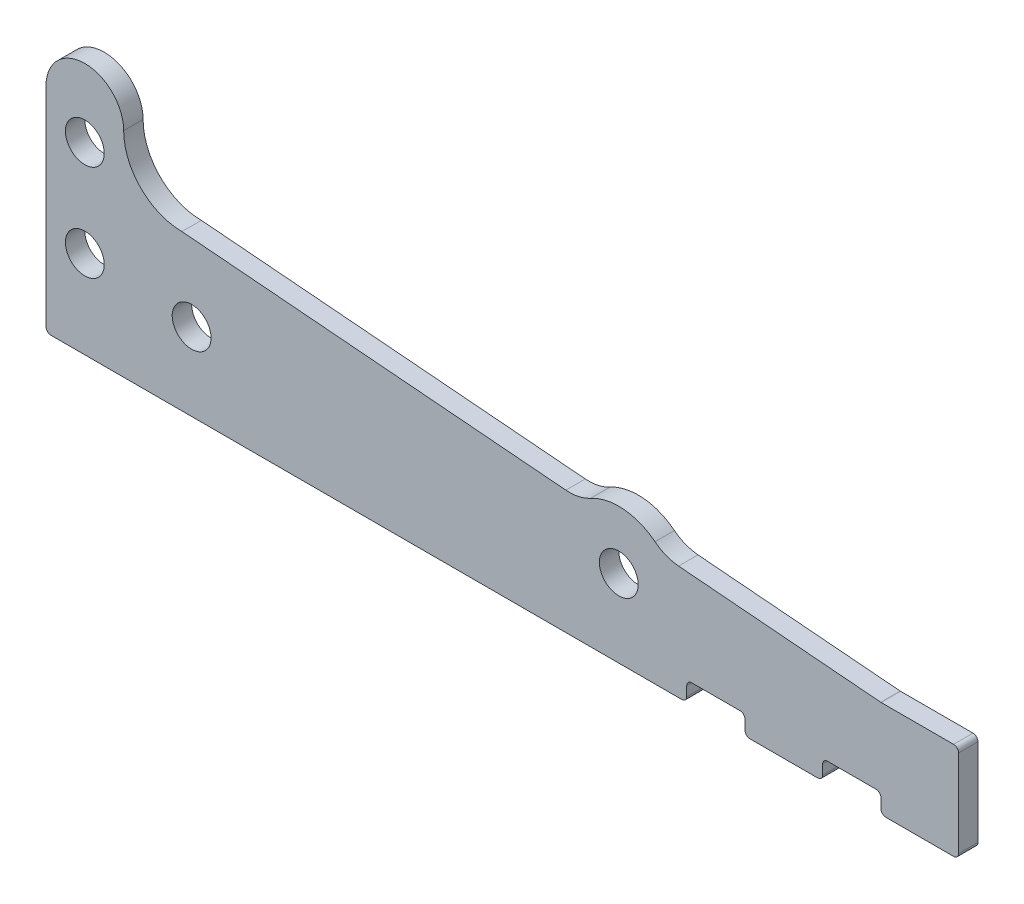
from build123d import *

# Parameters (mm, degrees)
SKETCH1_R           = 1.5875
BOSS_EXTRUDE1_DEPTH = 1.5875
FILLET1_R           = 0.4064
FILLET2_R           = 3.571875


with BuildPart() as part:
    # Sketch1 → Boss-Extrude1 (new body)
    with BuildSketch(Plane.XY):
        with BuildLine():
            Line((0, -1.5875), (52.3875, -1.5875))
            Line((52.3875, -1.5875), (52.3875, 0))
            Line((52.3875, 0), (57.15, 0))
            Line((57.15, 0), (57.15, -1.5875))
            Line((57.15, -1.5875), (63.5, -1.5875))
            Line((63.5, -1.5875), (63.5, 0))
            Line((63.5, 0), (68.2625, 0))
            Line((68.2625, 0), (68.2625, -1.5875))
            Line((68.2625, -1.5875), (74.6125, -1.5875))
            Line((74.6125, -1.5875), (74.6125, 6.35))
            Line((74.6125, 6.35), (68.2625, 6.35))
            Line((68.2625, 6.35), (50.472175754, 7.832527021))
            ThreePointArc((50.472175754, 7.832527021), (47.226754098, 9.508549174), (43.748686315, 8.392817807))
            Line((43.748686315, 8.392817807), (11.1125, 11.1125))
            ThreePointArc((11.1125, 11.1125), (7.744903955, 12.507403955), (6.35, 15.875))
            ThreePointArc((6.35, 15.875), (3.175, 19.05), (0, 15.875))
            Line((0, 15.875), (0, -1.5875))
        make_face()
        with Locations((3.175, 5.588)):
            Circle(SKETCH1_R, mode=Mode.SUBTRACT)
        with Locations((3.175, 13.462)):
            Circle(SKETCH1_R, mode=Mode.SUBTRACT)
        with Locations((11.90625, 4.7625)):
            Circle(SKETCH1_R, mode=Mode.SUBTRACT)
        with Locations((46.83125, 4.7625)):
            Circle(SKETCH1_R, mode=Mode.SUBTRACT)
    extrude(amount=BOSS_EXTRUDE1_DEPTH)

    # Fillet1
    fillet1_edges = [part.edges().sort_by_distance(p)[0] for p in [
        (68.2625, 6.35, 0.79375),
        (74.6125, 6.35, 0.79375),
        (74.6125, -1.5875, 0.79375),
        (68.2625, -1.5875, 0.79375),
        (68.2625, 0, 0.79375),
        (63.5, 0, 0.79375),
        (63.5, -1.5875, 0.79375),
        (57.15, -1.5875, 0.79375),
        (57.15, 0, 0.79375),
        (52.3875, 0, 0.79375),
        (52.3875, -1.5875, 0.79375),
        (0, -1.5875, 0.79375),
    ]]
    fillet(fillet1_edges, radius=FILLET1_R)

    # Fillet2
    fillet2_edges = [part.edges().sort_by_distance(p)[0] for p in [
        (43.748686315, 8.392817807, 0.79375),
        (50.472175754, 7.832527021, 0.79375),
    ]]
    fillet(fillet2_edges, radius=FILLET2_R)


solid = part.part
